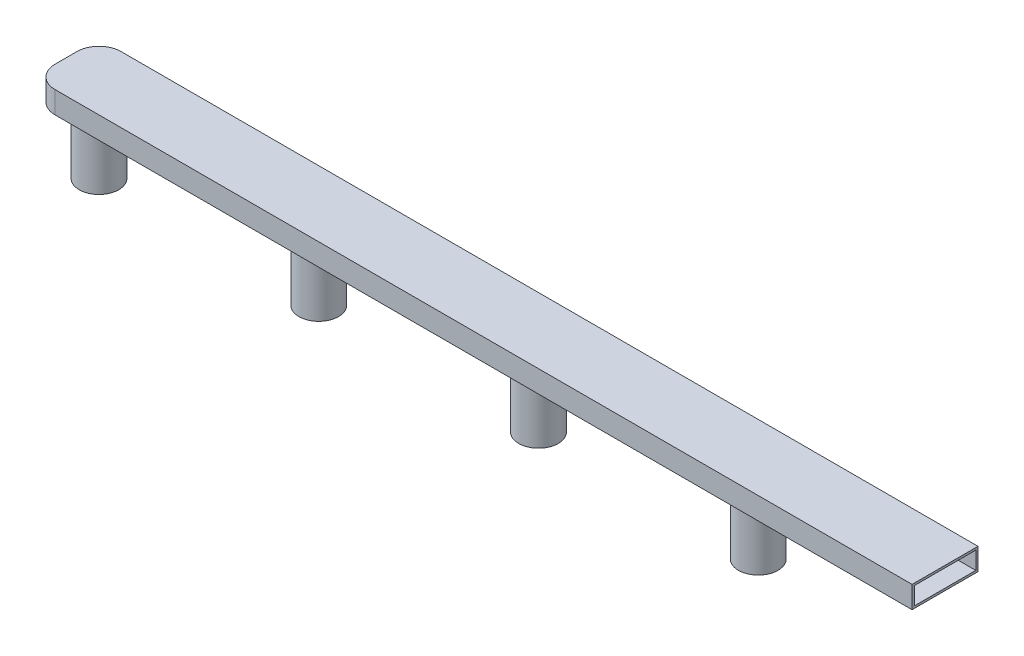
from build123d import *

# Parameters (mm, degrees)
SKETCH1_R             = 9
SKETCH1_R_2           = 6.5
BOSS_EXTRUDE1_DEPTH   = 30
BOSS_EXTRUDE1_2_DEPTH = 30
BOSS_EXTRUDE1_3_DEPTH = 30
BOSS_EXTRUDE1_4_DEPTH = 30
BOSS_EXTRUDE2_DEPTH   = 10
SHELL3_T              = -1


with BuildPart() as part:
    # Sketch1 → Boss-Extrude1 (new body)
    with BuildSketch(Plane(origin=(0, 0, 0), x_dir=(1, 0, 0), z_dir=(0, 1, 0))):
        with Locations(Location((-150, 0, 0), (0, 0, 270))):
            Circle(SKETCH1_R)
        with Locations(Location((-150, 0, 0), (0, 0, 270))):
            Circle(SKETCH1_R_2, mode=Mode.SUBTRACT)
    extrude(amount=-BOSS_EXTRUDE1_DEPTH)


with BuildPart() as body_2:
    # Sketch1 → Boss-Extrude1 2 (new body)
    with BuildSketch(Plane(origin=(0, 0, 0), x_dir=(1, 0, 0), z_dir=(0, 1, 0))):
        with Locations(Location((-50, 0, 0), (0, 0, 270))):
            Circle(SKETCH1_R)
        with Locations(Location((-50, 0, 0), (0, 0, 270))):
            Circle(SKETCH1_R_2, mode=Mode.SUBTRACT)
    extrude(amount=-BOSS_EXTRUDE1_2_DEPTH)


with BuildPart() as body_3:
    # Sketch1 → Boss-Extrude1 3 (new body)
    with BuildSketch(Plane(origin=(0, 0, 0), x_dir=(1, 0, 0), z_dir=(0, 1, 0))):
        with Locations(Location((50, 0, 0), (0, 0, 270))):
            Circle(SKETCH1_R)
        with Locations(Location((50, 0, 0), (0, 0, 270))):
            Circle(SKETCH1_R_2, mode=Mode.SUBTRACT)
    extrude(amount=-BOSS_EXTRUDE1_3_DEPTH)


with BuildPart() as body_4:
    # Sketch1 → Boss-Extrude1 4 (new body)
    with BuildSketch(Plane(origin=(0, 0, 0), x_dir=(1, 0, 0), z_dir=(0, 1, 0))):
        with Locations(Location((150, 0, 0), (0, 0, 270))):
            Circle(SKETCH1_R)
        with Locations(Location((150, 0, 0), (0, 0, 270))):
            Circle(SKETCH1_R_2, mode=Mode.SUBTRACT)
    extrude(amount=-BOSS_EXTRUDE1_4_DEPTH)


with BuildPart() as body_5:
    # Sketch2 → Boss-Extrude2 (new body)
    with BuildSketch(Plane(origin=(0, 0, 0), x_dir=(1, 0, 0), z_dir=(0, 1, 0))):
        with BuildLine():
            Line((-155, 15), (235, 15))
            Line((235, 15), (235, -15))
            Line((235, -15), (-155, -15))
            ThreePointArc((-155, -15), (-162.071067812, -12.071067812), (-165, -5))
            Line((-165, -5), (-165, 5))
            ThreePointArc((-165, 5), (-162.071067812, 12.071067812), (-155, 15))
        make_face()
    extrude(amount=BOSS_EXTRUDE2_DEPTH)

    # Shell3
    shell3_openings = [body_5.faces().sort_by_distance(p)[0] for p in [
        (235, 5, 0),
    ]]
    offset(amount=SHELL3_T, openings=shell3_openings, kind=Kind.INTERSECTION)


solid = Compound([part.part, body_2.part, body_3.part, body_4.part, body_5.part])
